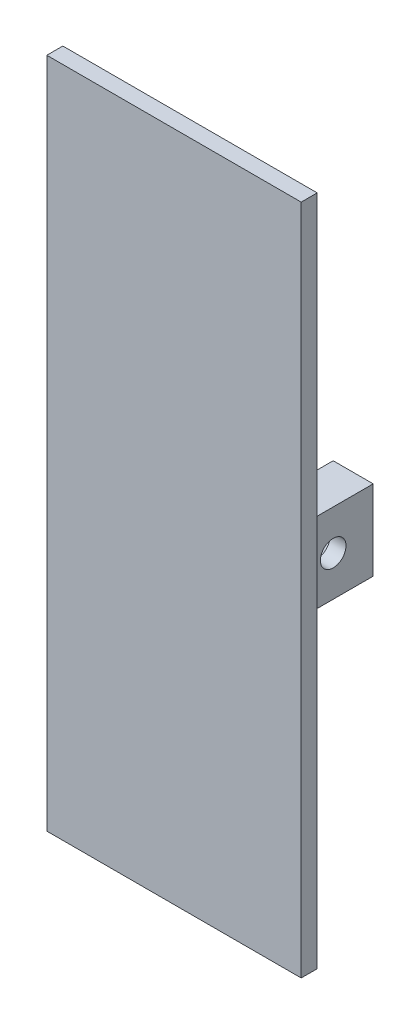
from build123d import *

# Parameters (mm, degrees)
SKETCH1_W           = 31.8
SKETCH1_H           = 84
BOSS_EXTRUDE1_DEPTH = 2
SKETCH2_W           = 27.8
SKETCH2_H           = 79.9
BOSS_EXTRUDE2_DEPTH = 0.001
SKETCH3_W           = 5
SKETCH3_H           = 10
BOSS_EXTRUDE3_DEPTH = 9
CUT_EXTRUDE1_DEPTH  = 3
SKETCH5_R           = 1.6
CUT_EXTRUDE2_DEPTH  = 2


with BuildPart() as part:
    # Sketch1 → Boss-Extrude1 (new body)
    with BuildSketch(Plane.XY):
        Rectangle(SKETCH1_W, SKETCH1_H)
    extrude(amount=BOSS_EXTRUDE1_DEPTH)

    # Sketch2 → Boss-Extrude2 (add)
    with BuildSketch(Plane(origin=(0, 0, 0), x_dir=(-1, 0, 0), z_dir=(0, 0, -1))):
        Rectangle(SKETCH2_W, SKETCH2_H)
    extrude(amount=BOSS_EXTRUDE2_DEPTH)

    # Sketch3 → Boss-Extrude3 (add)
    with BuildSketch(Plane(origin=(0, 0, 0), x_dir=(-1, 0, 0), z_dir=(0, 0, -1))):
        with Locations((-11.4, 0)):
            Rectangle(SKETCH3_W, SKETCH3_H)
    extrude(amount=BOSS_EXTRUDE3_DEPTH)

    # Sketch4 → Cut-Extrude1 (cut)
    with BuildSketch(Plane.ZY.offset(-8.9)):
        Polygon((-2.41228676, 2.75), (-5.58771324, 2.75), (-7.175426481, 0), (-5.58771324, -2.75), (-2.41228676, -2.75), (-0.824573519, 0), align=None)
    extrude(amount=-CUT_EXTRUDE1_DEPTH, mode=Mode.SUBTRACT)

    # Sketch5 → Cut-Extrude2 (cut)
    with BuildSketch(Plane.ZY.offset(-11.9)):
        with Locations((-4, 0)):
            Circle(SKETCH5_R)
    extrude(amount=-CUT_EXTRUDE2_DEPTH, mode=Mode.SUBTRACT)


solid = part.part
